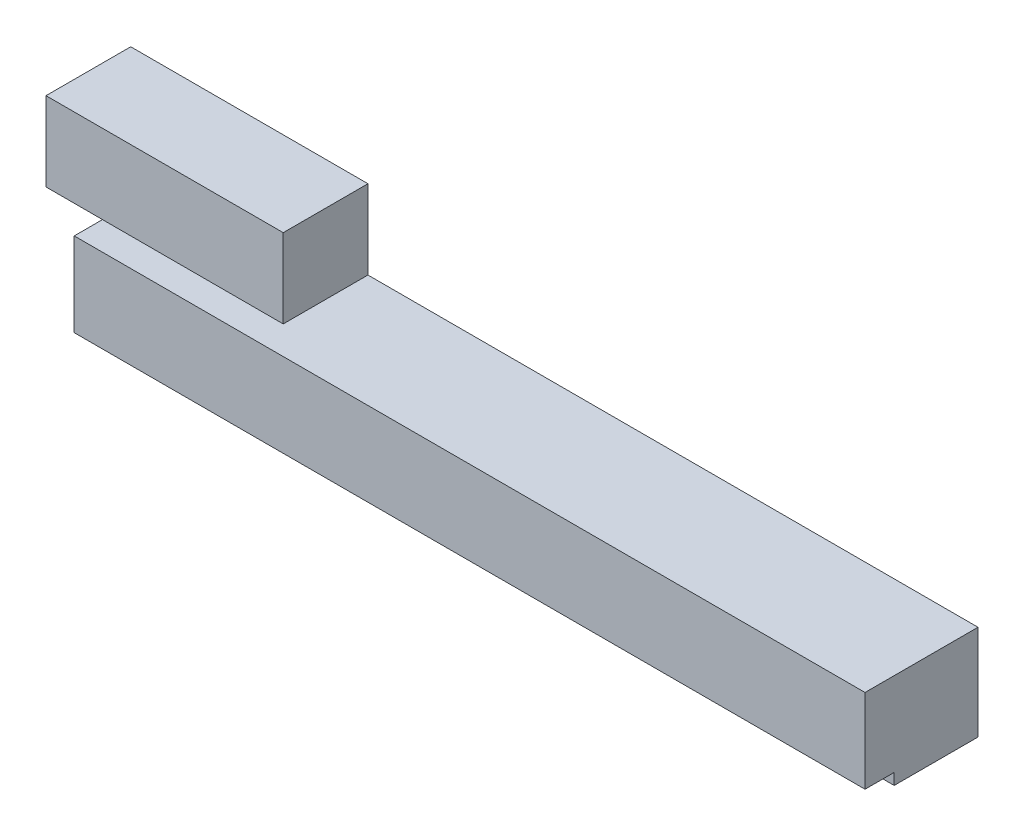
from build123d import *

# Parameters (mm, degrees)
BOSS_EXTRUDE1_DEPTH = 140
SKETCH2_W           = 42
SKETCH2_H           = 15
BOSS_EXTRUDE2_DEPTH = 14


with BuildPart() as part:
    # Sketch1 → Boss-Extrude1 (new body)
    with BuildSketch(Plane(origin=(0, 0, 0), x_dir=(0, 0, -1), z_dir=(1, 0, 0))):
        Polygon((-10, 8.42), (-10, -6.42), (-4.84, -6.42), (-4.84, -8.42), (10, -8.42), (10, 8.42), align=None)
    extrude(amount=BOSS_EXTRUDE1_DEPTH)

    # Sketch2 → Boss-Extrude2 (add)
    with BuildSketch(Plane(origin=(0, 8.42, 0), x_dir=(1, 0, 0), z_dir=(0, 1, 0))):
        with Locations((11, 2.5)):
            Rectangle(SKETCH2_W, SKETCH2_H)
    extrude(amount=BOSS_EXTRUDE2_DEPTH)


solid = part.part
